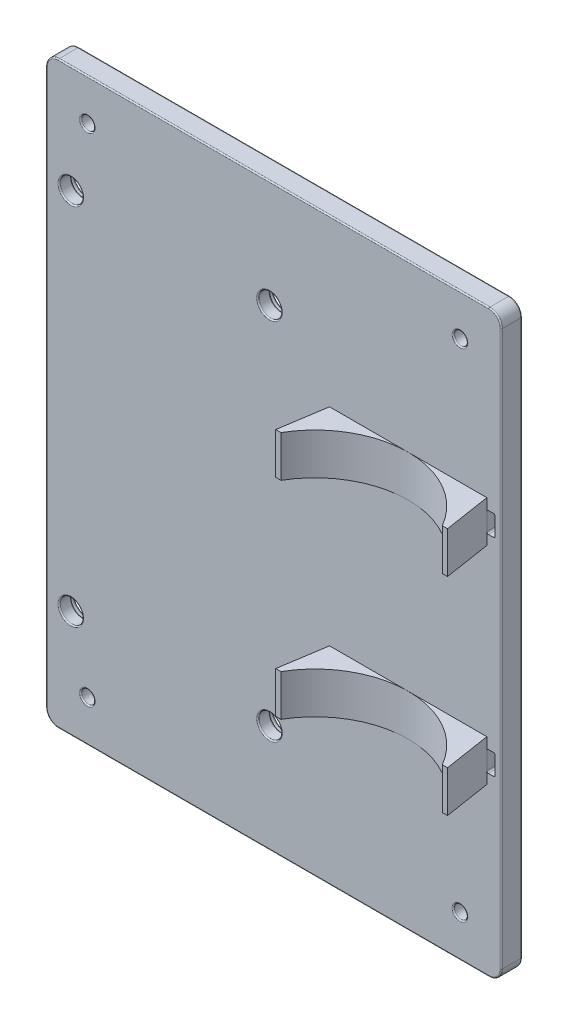
from build123d import *

# Parameters (mm, degrees)
SKETCH1_R           = 2.8
SKETCH1_R_2         = 1.6
BOSS_EXTRUDE1_DEPTH = 5
SKETCH2_R           = 4.5
CUT_EXTRUDE1_DEPTH  = 2
SKETCH3_W           = 45
SKETCH3_H           = 10
BOSS_EXTRUDE2_DEPTH = 22.5
CUT_EXTRUDE2_REACH  = 153.183
FILLET1_R           = 0.3


with BuildPart() as part:
    # Sketch1 → Boss-Extrude1 (new body)
    with BuildSketch(Plane.XY):
        with BuildLine():
            Line((3, 0), (107, 0))
            ThreePointArc((107, 0), (109.121320344, 0.878679656), (110, 3))
            Line((110, 3), (110, 137))
            ThreePointArc((110, 137), (109.121320344, 139.121320344), (107, 140))
            Line((107, 140), (3, 140))
            ThreePointArc((3, 140), (0.878679656, 139.121320344), (0, 137))
            Line((0, 137), (0, 3))
            ThreePointArc((0, 3), (0.878679656, 0.878679656), (3, 0))
        make_face()
        with Locations((6, 26)):
            Circle(SKETCH1_R, mode=Mode.SUBTRACT)
        with Locations((54, 26)):
            Circle(SKETCH1_R, mode=Mode.SUBTRACT)
        with Locations((54, 114)):
            Circle(SKETCH1_R, mode=Mode.SUBTRACT)
        with Locations((6, 114)):
            Circle(SKETCH1_R, mode=Mode.SUBTRACT)
        with Locations((10, 130)):
            Circle(SKETCH1_R_2, mode=Mode.SUBTRACT)
        with Locations((100, 130)):
            Circle(SKETCH1_R_2, mode=Mode.SUBTRACT)
        with Locations((10, 10)):
            Circle(SKETCH1_R_2, mode=Mode.SUBTRACT)
        with Locations((100, 10)):
            Circle(SKETCH1_R_2, mode=Mode.SUBTRACT)
        with BuildLine():
            Line((106.5, 97.1), (106.5, 92.9))
            ThreePointArc((106.5, 92.9), (106.617157288, 92.617157288), (106.9, 92.5))
            Line((106.9, 92.5), (108.1, 92.5))
            ThreePointArc((108.1, 92.5), (108.382842712, 92.617157288), (108.5, 92.9))
            Line((108.5, 92.9), (108.5, 97.1))
            ThreePointArc((108.5, 97.1), (108.382842712, 97.382842712), (108.1, 97.5))
            Line((108.1, 97.5), (106.9, 97.5))
            ThreePointArc((106.9, 97.5), (106.617157288, 97.382842712), (106.5, 97.1))
        make_face(mode=Mode.SUBTRACT)
        with BuildLine():
            Line((106.5, 47.1), (106.5, 42.9))
            ThreePointArc((106.5, 42.9), (106.617157288, 42.617157288), (106.9, 42.5))
            Line((106.9, 42.5), (108.1, 42.5))
            ThreePointArc((108.1, 42.5), (108.382842712, 42.617157288), (108.5, 42.9))
            Line((108.5, 42.9), (108.5, 47.1))
            ThreePointArc((108.5, 47.1), (108.382842712, 47.382842712), (108.1, 47.5))
            Line((108.1, 47.5), (106.9, 47.5))
            ThreePointArc((106.9, 47.5), (106.617157288, 47.382842712), (106.5, 47.1))
        make_face(mode=Mode.SUBTRACT)
        with BuildLine():
            Line((66.5, 47.1), (66.5, 42.9))
            ThreePointArc((66.5, 42.9), (66.617157288, 42.617157288), (66.9, 42.5))
            Line((66.9, 42.5), (68.1, 42.5))
            ThreePointArc((68.1, 42.5), (68.382842712, 42.617157288), (68.5, 42.9))
            Line((68.5, 42.9), (68.5, 47.1))
            ThreePointArc((68.5, 47.1), (68.382842712, 47.382842712), (68.1, 47.5))
            Line((68.1, 47.5), (66.9, 47.5))
            ThreePointArc((66.9, 47.5), (66.617157288, 47.382842712), (66.5, 47.1))
        make_face(mode=Mode.SUBTRACT)
        with BuildLine():
            Line((66.5, 97.1), (66.5, 92.9))
            ThreePointArc((66.5, 92.9), (66.617157288, 92.617157288), (66.9, 92.5))
            Line((66.9, 92.5), (68.1, 92.5))
            ThreePointArc((68.1, 92.5), (68.382842712, 92.617157288), (68.5, 92.9))
            Line((68.5, 92.9), (68.5, 97.1))
            ThreePointArc((68.5, 97.1), (68.382842712, 97.382842712), (68.1, 97.5))
            Line((68.1, 97.5), (66.9, 97.5))
            ThreePointArc((66.9, 97.5), (66.617157288, 97.382842712), (66.5, 97.1))
        make_face(mode=Mode.SUBTRACT)
    extrude(amount=BOSS_EXTRUDE1_DEPTH)

    # Sketch2 → Cut-Extrude1 (cut)
    with BuildSketch(Plane(origin=(0, 0, 0), x_dir=(-1, 0, 0), z_dir=(0, 0, -1))):
        with Locations((-54, 114)):
            Circle(SKETCH2_R)
        with Locations((-54, 26)):
            Circle(SKETCH2_R)
        with Locations((-6, 26)):
            Circle(SKETCH2_R)
        with Locations((-6, 114)):
            Circle(SKETCH2_R)
        with BuildLine():
            Line((-108.11910915, 97.5), (-66.9, 97.5))
            ThreePointArc((-66.9, 97.5), (-66.617157288, 97.382842712), (-66.5, 97.1))
            Line((-66.5, 97.1), (-66.5, 92.9))
            ThreePointArc((-66.5, 92.9), (-66.617157288, 92.617157288), (-66.9, 92.5))
            Line((-66.9, 92.5), (-108.11910915, 92.5))
            ThreePointArc((-108.11910915, 92.5), (-108.401951863, 92.617157288), (-108.51910915, 92.9))
            Line((-108.51910915, 92.9), (-108.51910915, 97.1))
            ThreePointArc((-108.51910915, 97.1), (-108.401951863, 97.382842712), (-108.11910915, 97.5))
        make_face()
        with BuildLine():
            Line((-108.1, 47.5), (-66.9, 47.5))
            ThreePointArc((-66.9, 47.5), (-66.617157288, 47.382842712), (-66.5, 47.1))
            Line((-66.5, 47.1), (-66.5, 42.9))
            ThreePointArc((-66.5, 42.9), (-66.617157288, 42.617157288), (-66.9, 42.5))
            Line((-66.9, 42.5), (-108.1, 42.5))
            ThreePointArc((-108.1, 42.5), (-108.382842712, 42.617157288), (-108.5, 42.9))
            Line((-108.5, 42.9), (-108.5, 47.1))
            ThreePointArc((-108.5, 47.1), (-108.382842712, 47.382842712), (-108.1, 47.5))
        make_face()
    extrude(amount=-CUT_EXTRUDE1_DEPTH, mode=Mode.SUBTRACT)

    # Sketch3 → Boss-Extrude2 (add)
    with BuildSketch(Plane.XY.offset(5)):
        with Locations((87.5, 45)):
            Rectangle(SKETCH3_W, SKETCH3_H)
        with Locations((87.5, 95)):
            Rectangle(SKETCH3_W, SKETCH3_H)
    extrude(amount=BOSS_EXTRUDE2_DEPTH)

    # Cut-Extrude2: up to this face of the body (flat: up to its plane)
    cut_extrude2_end = Plane(part.part.faces().sort_by_distance((87.5, 100, 16.25))[0])
    # Sketch4 → Cut-Extrude2 (cut, up to the picked face)
    with BuildSketch(Plane.XZ.offset(-40), mode=Mode.PRIVATE) as cut_extrude2_sk1:
        with BuildLine():
            Line((66.75, 16.25), (68.014428415, 16.25))
            ThreePointArc((68.014428415, 16.25), (87.5, 5), (106.985571585, 16.25))
            Line((106.985571585, 16.25), (108.25, 16.25))
            Line((108.25, 16.25), (106.5, 5))
            Line((106.5, 5), (110, 5))
            Line((110, 5), (110, 27.5))
            Line((110, 27.5), (65, 27.5))
            Line((65, 27.5), (65, 5))
            Line((65, 5), (68.5, 5))
            Line((68.5, 5), (66.75, 16.25))
        make_face()
    cut_extrude2_tool1 = split(extrude(cut_extrude2_sk1.sketch, amount=-CUT_EXTRUDE2_REACH, mode=Mode.PRIVATE), bisect_by=cut_extrude2_end, keep=Keep.BOTH, mode=Mode.PRIVATE)
    add(cut_extrude2_tool1.solids().sort_by(Axis((87.5, 40, 17.441683), (0, 1, 0)))[0], mode=Mode.SUBTRACT)

    # Fillet1
    fillet1_edges = [part.edges().sort_by_distance(p)[0] for p in [
        (55, 140, 0),
        (109.121320344, 139.121320344, 0),
        (66.617157288, 47.382842712, 0),
        (66.5, 45, 0),
        (66.617157288, 42.617157288, 0),
        (110, 70, 0),
        (109.121320344, 0.878679656, 0),
        (109.121320344, 139.121320344, 5),
        (66.617157288, 97.382842712, 0),
        (66.5, 95, 0),
        (66.617157288, 92.617157288, 0),
        (55, 140, 5),
        (51.2, 26, 2),
        (58.5, 26, 0),
        (3.2, 26, 2),
        (10.5, 26, 0),
        (3.2, 114, 2),
        (10.5, 114, 0),
        (0.878679656, 139.121320344, 5),
        (108.401951863, 97.382842712, 0),
        (108.51910915, 95, 0),
        (108.401951863, 92.617157288, 0),
        (3.2, 26, 5),
        (51.2, 114, 2),
        (58.5, 114, 0),
        (0, 70, 5),
        (51.2, 26, 5),
        (0.878679656, 0.878679656, 5),
        (51.2, 114, 5),
        (55, 0, 5),
        (3.2, 114, 5),
        (87.509554575, 97.5, 0),
        (87.509554575, 92.5, 0),
        (109.121320344, 0.878679656, 5),
        (8.4, 130, 0),
        (8.4, 130, 5),
        (98.4, 130, 0),
        (98.4, 130, 5),
        (8.4, 10, 0),
        (8.4, 10, 5),
        (98.4, 10, 0),
        (98.4, 10, 5),
        (108.382842712, 47.382842712, 0),
        (87.5, 47.5, 0),
        (87.5, 42.5, 0),
        (108.382842712, 42.617157288, 0),
        (108.5, 45, 0),
        (55, 0, 0),
        (110, 70, 5),
        (0.878679656, 0.878679656, 0),
        (0, 70, 0),
        (0.878679656, 139.121320344, 0),
    ]]
    fillet(fillet1_edges, radius=FILLET1_R)


solid = part.part
